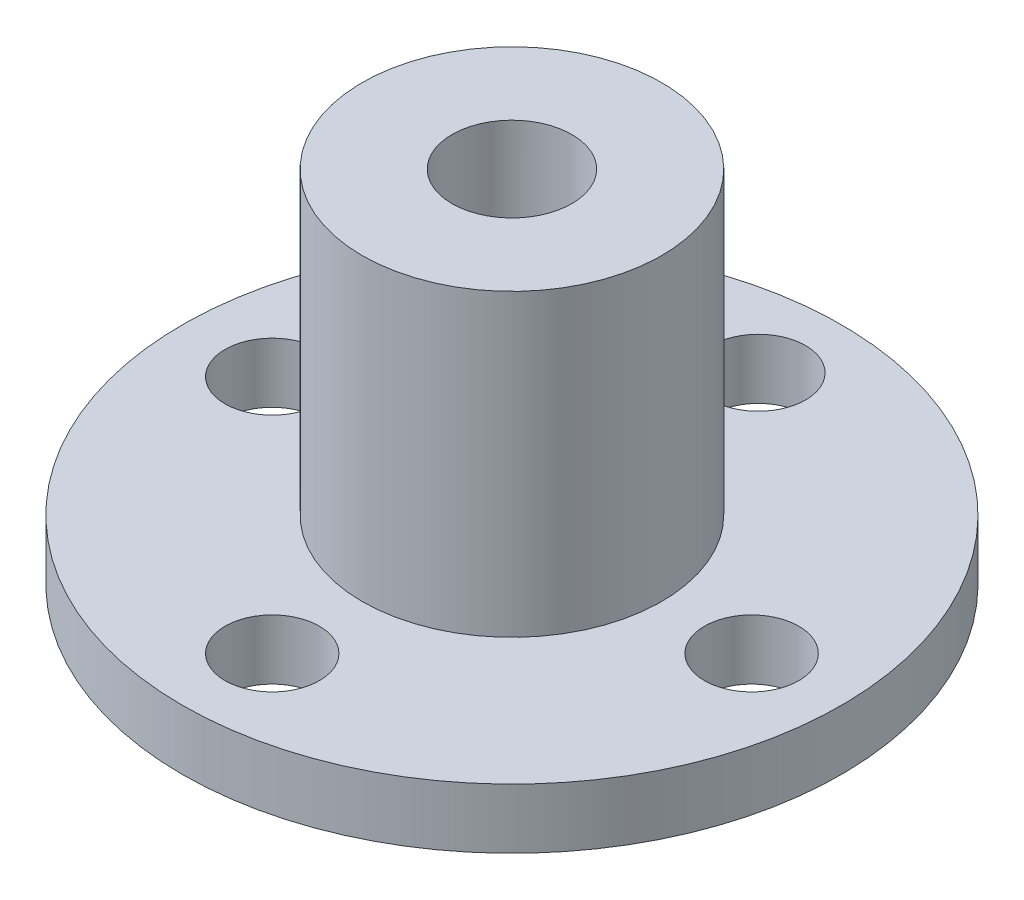
from build123d import *

# Parameters (mm, degrees)
SKETCH_2_R            = 11
EXTRUDE_1_DEPTH       = 2
SKETCH_7_R            = 5
EXTRUDE_2_DEPTH       = 10
CUT_EXTRUDE_3_REACH   = 21.647
SKETCH_8_R            = 2
HOLE_WIZARD_M31_D     = 3.15
HOLE_WIZARD_M31_DEPTH = 8
HOLE_WIZARD_M31_TIP   = 0.946355475
SKETCH_12_R           = 1.5
CUT_EXTRUDE_4_DEPTH   = 10


with BuildPart() as part:
    # Эскиз2 → Бобышка-Вытянуть1 (new body)
    with BuildSketch(Plane(origin=(0, 0, 0), x_dir=(1, 0, 0), z_dir=(0, 1, 0))):
        with Locations(Location((0, 0, 0), (0, 0, 270))):
            Circle(SKETCH_2_R)
    extrude(amount=EXTRUDE_1_DEPTH)

    # Эскиз7 → Бобышка-Вытянуть2 (add)
    with BuildSketch(Plane(origin=(0, 2, 0), x_dir=(1, 0, 0), z_dir=(0, 1, 0))):
        with Locations(Location((0, 0, 0), (0, 0, 270))):
            Circle(SKETCH_7_R)
    extrude(amount=EXTRUDE_2_DEPTH)

    # Эскиз8 → Вырез-Вытянуть3 (cut, up to next)
    with BuildSketch(Plane(origin=(0, 12, 0), x_dir=(1, 0, 0), z_dir=(0, 1, 0)), mode=Mode.PRIVATE) as cut_extrude_3_sk1:
        with Locations(Location((0, 0, 0), (0, 0, 270))):
            Circle(SKETCH_8_R)
    cut_extrude_3_tool1 = extrude(cut_extrude_3_sk1.sketch, amount=-CUT_EXTRUDE_3_REACH, mode=Mode.PRIVATE) & part.part
    add(cut_extrude_3_tool1.solids().sort_by_distance((0, 12, 0))[0], mode=Mode.SUBTRACT)

    # Сверло под метчик  спиральное M31
    with Locations(Plane(origin=(0, 2, 0), x_dir=(1, 0, 0), z_dir=(0, 1, 0))):
        with Locations((0, -8), (-8, 0), (0, 8.225054206), (8, 0)):
            Hole(HOLE_WIZARD_M31_D / 2, depth=HOLE_WIZARD_M31_DEPTH)
            with Locations((0, 0, -(HOLE_WIZARD_M31_DEPTH + HOLE_WIZARD_M31_TIP / 2))):  # 118° drill point
                Cone(0, HOLE_WIZARD_M31_D / 2, HOLE_WIZARD_M31_TIP, mode=Mode.SUBTRACT)

    # Эскиз12 → Вырез-Вытянуть4 (cut)
    with BuildSketch(Plane.XY):
        with Locations((0, 7)):
            Circle(SKETCH_12_R)
    extrude(amount=-CUT_EXTRUDE_4_DEPTH, mode=Mode.SUBTRACT)


solid = part.part
